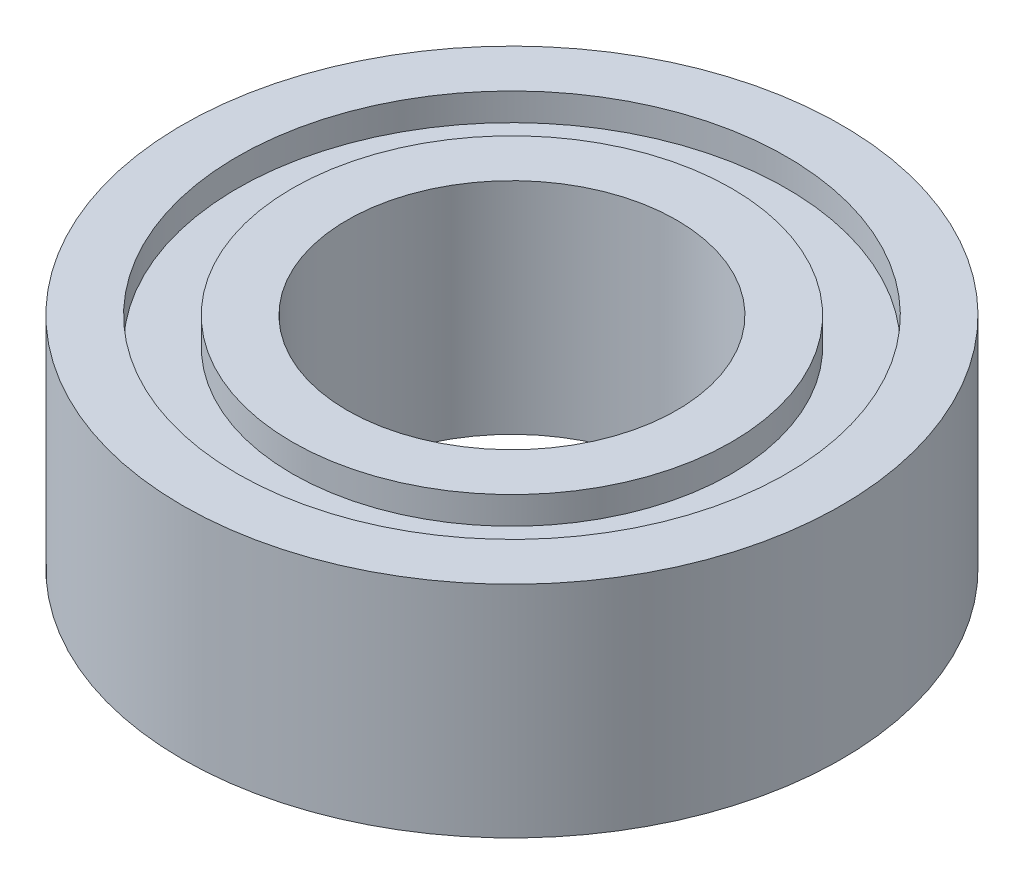
from build123d import *

# Parameters (mm, degrees)
SKETCH_1_R          = 6
SKETCH_1_R_2        = 3
EXTRUDE_1_DEPTH     = 2
SKETCH_2_R          = 5
SKETCH_2_R_2        = 4
CUT_EXTRUDE_1_DEPTH = 0.5


with BuildPart() as part:
    # 草图1 → 凸台-拉伸1 (new, symmetric)
    with BuildSketch(Plane(origin=(0, 0, 0), x_dir=(1, 0, 0), z_dir=(0, 1, 0))):
        with Locations(Location((0, 0, 0), (0, 0, 270))):
            Circle(SKETCH_1_R)
        with Locations(Location((0, 0, 0), (0, 0, 270))):
            Circle(SKETCH_1_R_2, mode=Mode.SUBTRACT)
    extrude(amount=EXTRUDE_1_DEPTH, both=True)

    # 草图2 → 切除-拉伸1 (cut)
    with BuildSketch(Plane(origin=(0, 2, 0), x_dir=(1, 0, 0), z_dir=(0, 1, 0))):
        with Locations(Location((0, 0, 0), (0, 0, 270))):
            Circle(SKETCH_2_R)
        with Locations(Location((0, 0, 0), (0, 0, 270))):
            Circle(SKETCH_2_R_2, mode=Mode.SUBTRACT)
    cut_extrude_1 = extrude(amount=-CUT_EXTRUDE_1_DEPTH, mode=Mode.SUBTRACT)

    # 镜向1: 切除-拉伸1 across plane
    add(cut_extrude_1.mirror(Plane.ZX), mode=Mode.SUBTRACT)


solid = part.part
